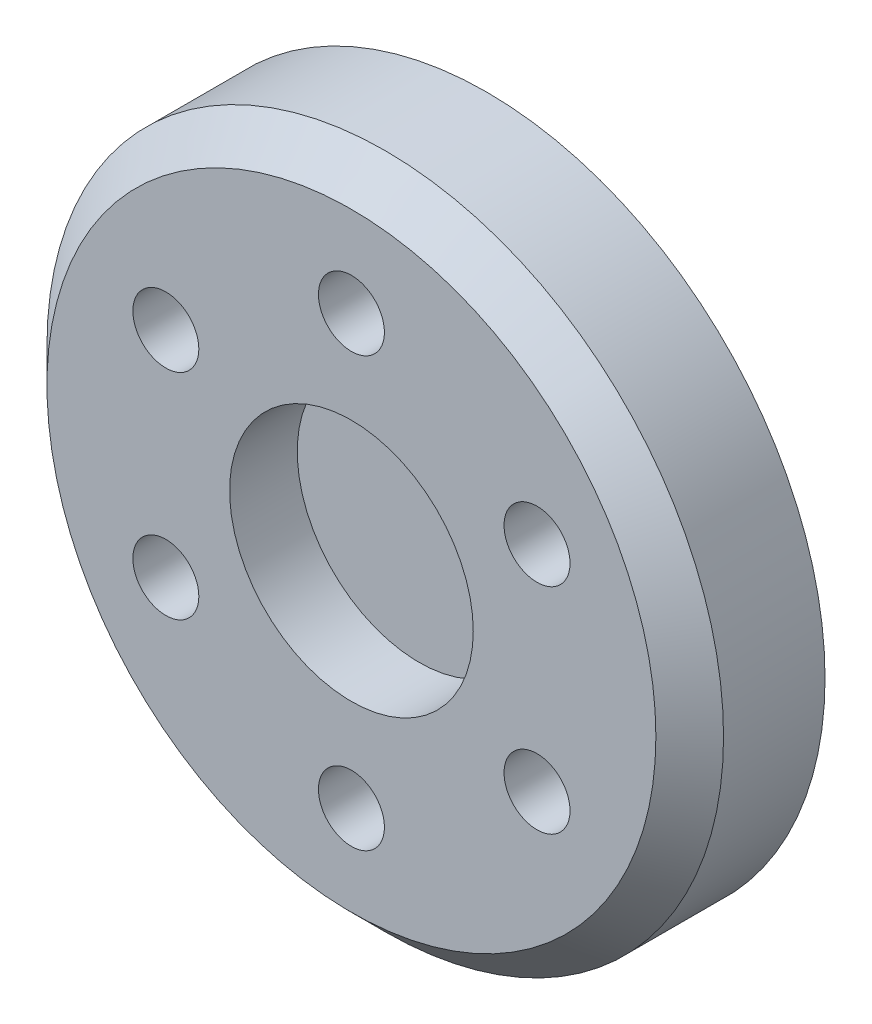
from build123d import *

# Parameters (mm, degrees)
SKETCH1_R           = 15
BOSS_EXTRUDE1_DEPTH = 20
SKETCH3_R           = 50
BOSS_EXTRUDE2_DEPTH = 20
CHAMFER1_SIZE       = 5
SKETCH4_R           = 4.876598491
SKETCH4_R_2         = 18.007662835
CUT_EXTRUDE1_DEPTH  = 10
SKETCH5_R           = 20
BOSS_EXTRUDE3_DEPTH = 5


with BuildPart() as part:
    # Sketch1 → Boss-Extrude1 (new body)
    with BuildSketch(Plane.XY):
        Circle(SKETCH1_R)
    extrude(amount=BOSS_EXTRUDE1_DEPTH)

    # Sketch3 → Boss-Extrude2 (add)
    with BuildSketch(Plane.XY.offset(20)):
        Circle(SKETCH3_R)
    extrude(amount=BOSS_EXTRUDE2_DEPTH)

    # Chamfer1
    chamfer1_edges = [part.edges().sort_by_distance(p)[0] for p in [
        (-50, 0, 40),
    ]]
    chamfer(chamfer1_edges, length=CHAMFER1_SIZE)

    # Sketch4 → Cut-Extrude1 (cut)
    with BuildSketch(Plane.XY.offset(40)):
        with Locations((27.429667962, 15.836526181)):
            Circle(SKETCH4_R)
        Circle(SKETCH4_R_2)
        with Locations((27.429667962, -15.836526181)):
            Circle(SKETCH4_R)
        with Locations((0, -31.673052363)):
            Circle(SKETCH4_R)
        with Locations((-27.429667961, -15.836526181)):
            Circle(SKETCH4_R)
        with Locations((-27.429667961, 15.836526181)):
            Circle(SKETCH4_R)
        with Locations((0, 31.673052363)):
            Circle(SKETCH4_R)
    extrude(amount=-CUT_EXTRUDE1_DEPTH, mode=Mode.SUBTRACT)

    # Sketch5 → Boss-Extrude3 (add)
    with BuildSketch(Plane(origin=(0, 0, 0), x_dir=(-1, 0, 0), z_dir=(0, 0, -1))):
        Circle(SKETCH5_R)
    extrude(amount=-BOSS_EXTRUDE3_DEPTH)


solid = part.part
